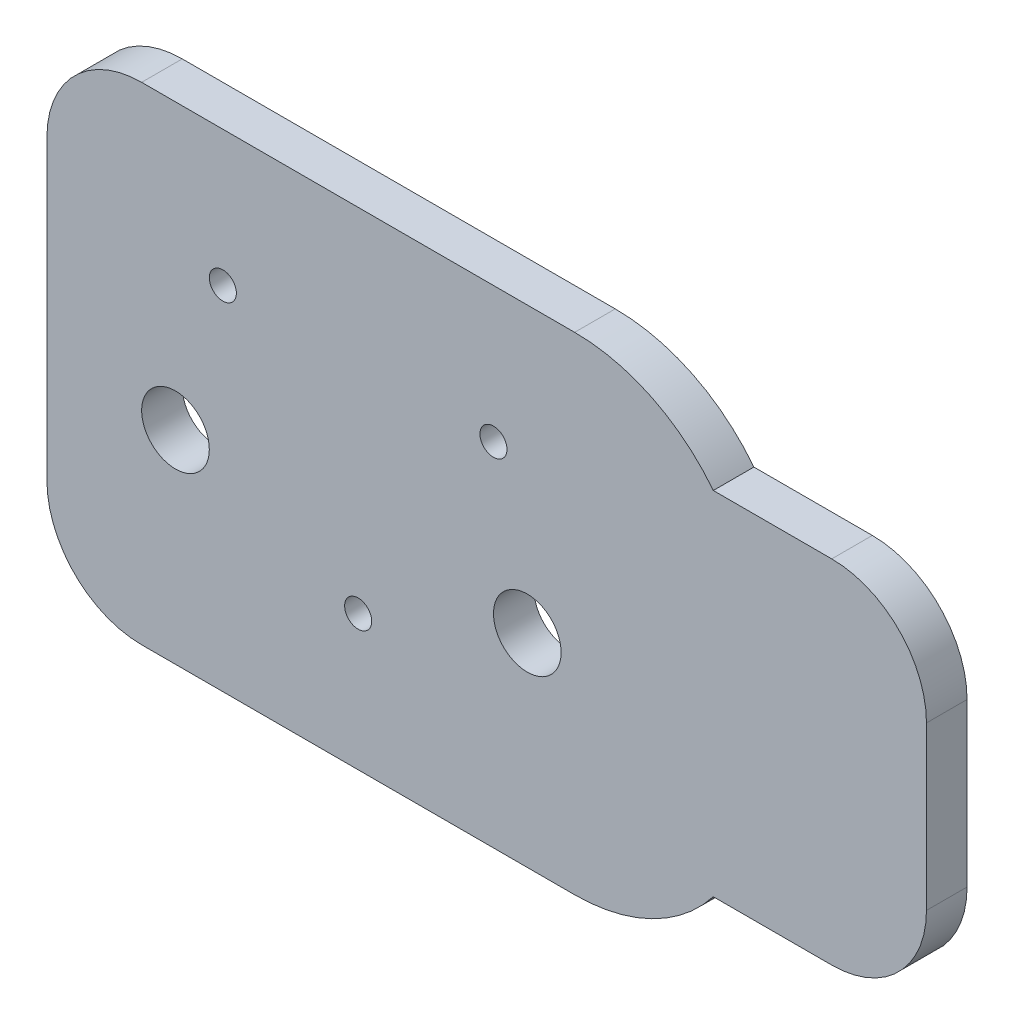
from build123d import *

# Parameters (mm, degrees)
INSERT_IN_SHEET_METAL_HOLE_DEPTH = 1
BACKING_DEPTH                    = 3
SCREWHOLES_DEPTH                 = 46.793012567
SCREWHOLES_DEPTH_BACK            = 46.793012567
SKETCH3_R                        = 1
WIRE_HOLES_DEPTH                 = 46.793012567
WIRE_HOLES_DEPTH_BACK            = 46.793012567
SKETCH4_R                        = 2.5


with BuildPart() as part:
    # Sketch1 → Insert in sheet metal hole (new body)
    with BuildSketch(Plane.XY):
        with BuildLine():
            Line((-18, 11), (-18, -11))
            ThreePointArc((-18, -11), (-17.414213562, -12.414213562), (-16, -13))
            Line((-16, -13), (16, -13))
            ThreePointArc((16, -13), (20, -11.92820323), (22.92820323, -9))
            ThreePointArc((22.92820323, -9), (23.660254038, -8.267949192), (24.660254038, -8))
            Line((24.660254038, -8), (35, -8))
            ThreePointArc((35, -8), (36.414213562, -7.414213562), (37, -6))
            Line((37, -6), (37, 6))
            ThreePointArc((37, 6), (36.414213562, 7.414213562), (35, 8))
            Line((35, 8), (24.660254038, 8))
            ThreePointArc((24.660254038, 8), (23.660254038, 8.267949192), (22.92820323, 9))
            ThreePointArc((22.92820323, 9), (20, 11.92820323), (16, 13))
            Line((16, 13), (-16, 13))
            ThreePointArc((-16, 13), (-17.414213562, 12.414213562), (-18, 11))
        make_face()
    extrude(amount=INSERT_IN_SHEET_METAL_HOLE_DEPTH)

    # Sketch2 → Backing (add)
    with BuildSketch(Plane.XY.offset(1)):
        with BuildLine():
            Line((26.246950766, -13), (35, -13))
            ThreePointArc((35, -13), (39.949747468, -10.949747468), (42, -6))
            Line((42, -6), (42, 6))
            ThreePointArc((42, 6), (39.949747468, 10.949747468), (35, 13))
            Line((35, 13), (26.246950766, 13))
            ThreePointArc((26.246950766, 13), (21.700877125, 16.683321446), (16, 18))
            Line((16, 18), (-16, 18))
            ThreePointArc((-16, 18), (-20.949747468, 15.949747468), (-23, 11))
            Line((-23, 11), (-23, -11))
            ThreePointArc((-23, -11), (-20.949747468, -15.949747468), (-16, -18))
            Line((-16, -18), (16, -18))
            ThreePointArc((16, -18), (21.700877125, -16.683321446), (26.246950766, -13))
        make_face()
    extrude(amount=-BACKING_DEPTH)

    # Sketch3 → Screwholes (cut, two sides: drawn at the far end of the back side and taken through both)
    with BuildSketch(Plane.XY.offset(1).offset(-SCREWHOLES_DEPTH_BACK)):
        with Locations((-10, 8)):
            Circle(SKETCH3_R)
        with Locations((10, 8)):
            Circle(SKETCH3_R)
        with Locations((0, -8)):
            Circle(SKETCH3_R)
    extrude(amount=SCREWHOLES_DEPTH + SCREWHOLES_DEPTH_BACK, mode=Mode.SUBTRACT)

    # Sketch4 → Wire holes (cut, two sides: drawn at the far end of the back side and taken through both)
    with BuildSketch(Plane.XY.offset(1).offset(-WIRE_HOLES_DEPTH_BACK)):
        with Locations((-13.5, -3)):
            Circle(SKETCH4_R)
        with Locations((12.5, -3)):
            Circle(SKETCH4_R)
    extrude(amount=WIRE_HOLES_DEPTH + WIRE_HOLES_DEPTH_BACK, mode=Mode.SUBTRACT)


solid = part.part
